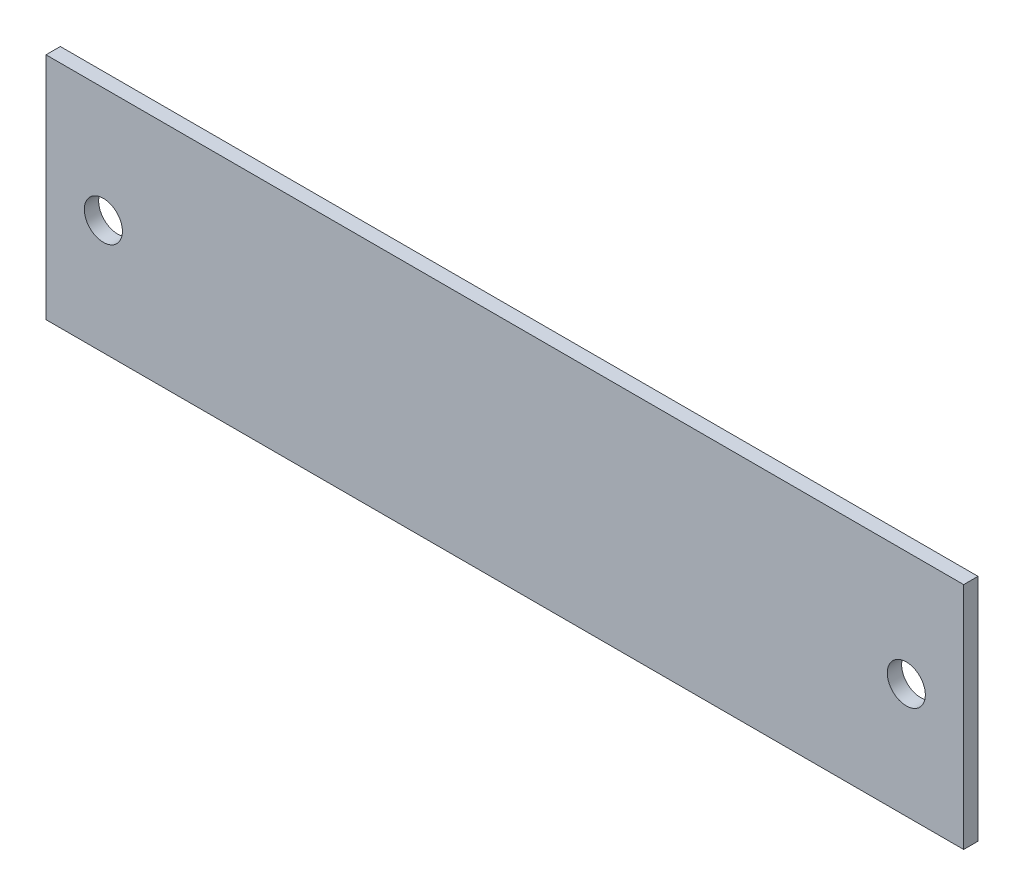
from build123d import *

# Parameters (mm, degrees)
SKETCH1_W           = 101.6
SKETCH1_H           = 25.4
SKETCH1_R           = 2.1082
BOSS_EXTRUDE1_DEPTH = 1.5875


with BuildPart() as part:
    # Sketch1 → Boss-Extrude1 (new body)
    with BuildSketch(Plane.XY):
        Rectangle(SKETCH1_W, SKETCH1_H)
        with Locations((-44.45, 0)):
            Circle(SKETCH1_R, mode=Mode.SUBTRACT)
        with Locations((44.45, 0)):
            Circle(SKETCH1_R, mode=Mode.SUBTRACT)
    extrude(amount=BOSS_EXTRUDE1_DEPTH)


solid = part.part
